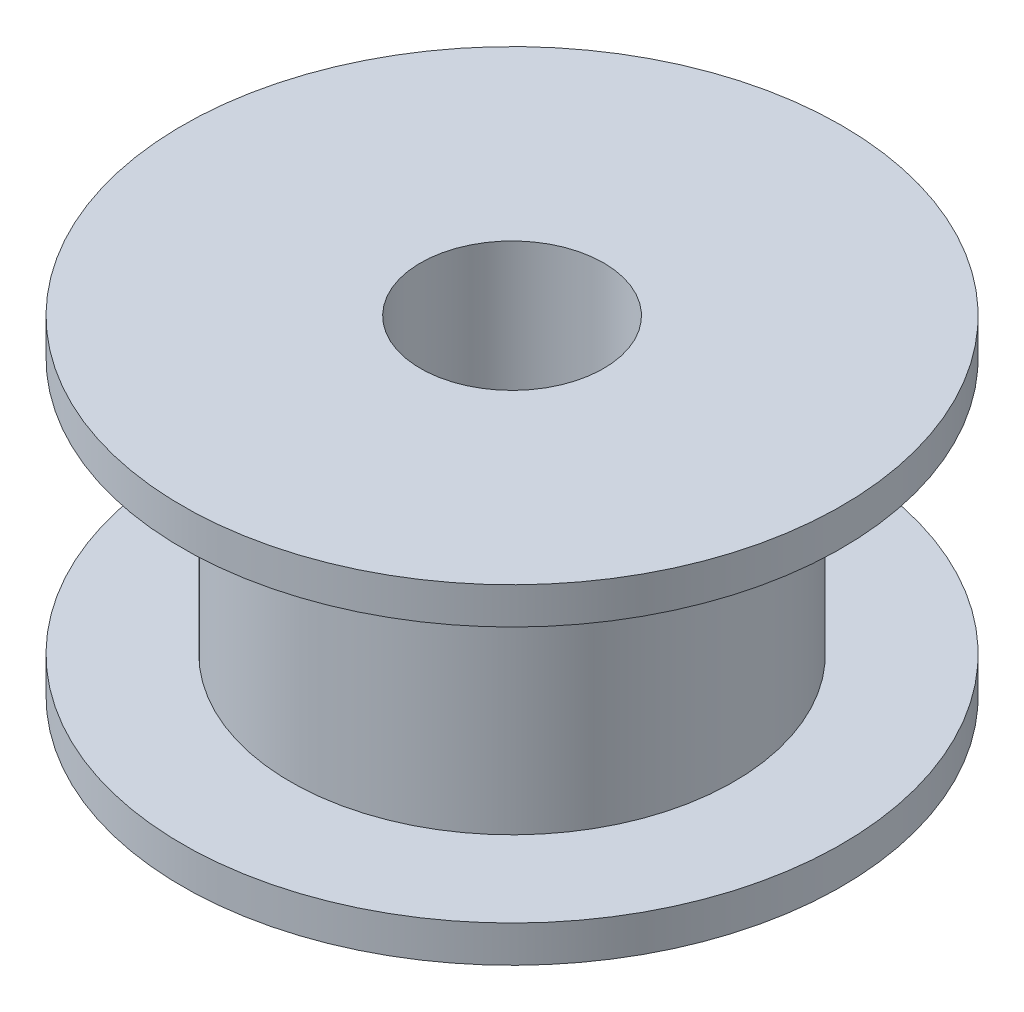
from build123d import *


with BuildPart() as part:
    # Sketch1 → Revolve1 (revolve)
    with BuildSketch(Plane.XY, mode=Mode.PRIVATE) as revolve1_sk:
        Polygon((-2.5, 0), (-9, 0), (-9, 1), (-6.05, 1), (-6.05, 8), (-9, 8), (-9, 9), (-2.5, 9), align=None)
    revolve(revolve1_sk.sketch.rotate(Axis((0, 0, 0), (0, 1, 0)), 270), axis=Axis((0, 0, 0), (0, 1, 0)))


solid = part.part
